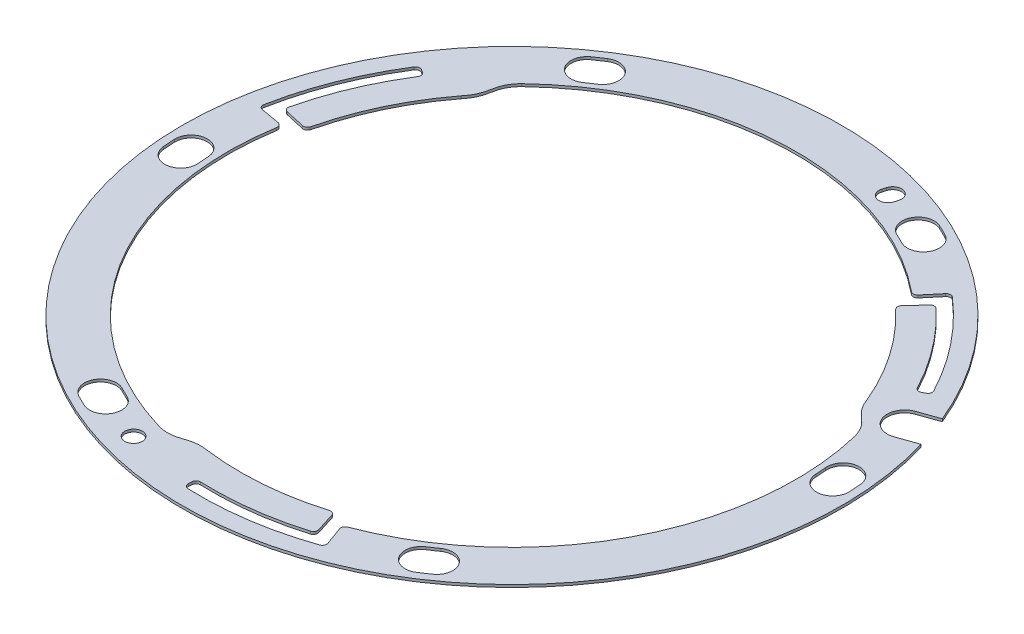
from build123d import *

# Parameters (mm, degrees)
SKETCH1_R               = 38
BOSS_EXTRUDE1_DEPTH     = 0.3
CUT_EXTRUDE1_DEPTH      = 54.740952727
CUT_EXTRUDE1_DEPTH_BACK = 54.740952727
SKETCH2_R               = 1.015
FILLET2_R               = 0.5


with BuildPart() as part:
    # Sketch1 → Boss-Extrude1 (new body)
    with BuildSketch(Plane(origin=(0, 0, 0), x_dir=(1, 0, 0), z_dir=(0, 1, 0))):
        with Locations(Location((0, 0, 0), (0, 0, 270))):
            Circle(SKETCH1_R)
    extrude(amount=BOSS_EXTRUDE1_DEPTH)

    # Sketch2 → Cut-Extrude1 (cut, two sides: drawn at the far end of the back side and taken through both)
    with BuildSketch(Plane(origin=(0, 0.3, 0), x_dir=(1, 0, 0), z_dir=(0, 1, 0)).offset(-CUT_EXTRUDE1_DEPTH_BACK)):
        with BuildLine():
            ThreePointArc((-37.053075912, -1.865359337), (-37.012379228, -2.548290386), (-36.959096408, -3.230354883))
            ThreePointArc((-36.959096408, -3.230354883), (-34.955040212, -4.912246307), (-33.273148788, -2.908190111))
            ThreePointArc((-33.273148788, -2.908190111), (-33.321117688, -2.294148218), (-33.357755673, -1.679326196))
            ThreePointArc((-33.357755673, -1.679326196), (-35.298432363, 0.075317353), (-37.053075912, -1.865359337))
        make_face()
        with BuildLine():
            ThreePointArc((-16.911089383, -33.021584697), (-16.299305403, -33.327805859), (-15.681978812, -33.622693832))
            ThreePointArc((-15.681978812, -33.622693832), (-13.223390014, -32.728075967), (-14.118007879, -30.26948717))
            ThreePointArc((-14.118007879, -30.26948717), (-14.673768207, -30.004008509), (-15.22453869, -29.728326924))
            ThreePointArc((-15.22453869, -29.728326924), (-17.714442923, -30.531680464), (-16.911089383, -33.021584697))
        make_face()
        with Locations(Location((-9.752534436, -33.874039795, 0), (0, 0, 270))):
            Circle(SKETCH2_R)
        with BuildLine():
            ThreePointArc((20.141986529, -31.15622536), (20.713073824, -30.779515473), (21.277117596, -30.392338949))
            ThreePointArc((21.277117596, -30.392338949), (21.731650198, -27.81582966), (19.155140909, -27.361297059))
            ThreePointArc((19.155140909, -27.361297059), (18.647349481, -27.709860291), (18.133216983, -28.049000728))
            ThreePointArc((18.133216983, -28.049000728), (17.58398944, -30.606997817), (20.141986529, -31.15622536))
        make_face()
        with BuildLine():
            ThreePointArc((37.053075912, 1.865359337), (37.012379228, 2.548290386), (36.959096408, 3.230354883))
            ThreePointArc((36.959096408, 3.230354883), (34.955040212, 4.912246307), (33.273148788, 2.908190111))
            ThreePointArc((33.273148788, 2.908190111), (33.321117688, 2.294148218), (33.357755673, 1.679326196))
            ThreePointArc((33.357755673, 1.679326196), (35.298432363, -0.075317353), (37.053075912, 1.865359337))
        make_face()
        with BuildLine():
            ThreePointArc((16.911089383, 33.021584697), (16.299305403, 33.327805859), (15.681978812, 33.622693832))
            ThreePointArc((15.681978812, 33.622693832), (13.223390014, 32.728075967), (14.118007879, 30.26948717))
            ThreePointArc((14.118007879, 30.26948717), (14.673768207, 30.004008509), (15.22453869, 29.728326924))
            ThreePointArc((15.22453869, 29.728326924), (17.714442923, 30.531680464), (16.911089383, 33.021584697))
        make_face()
        with BuildLine():
            ThreePointArc((-20.141986529, 31.15622536), (-20.713073824, 30.779515473), (-21.277117596, 30.392338949))
            ThreePointArc((-21.277117596, 30.392338949), (-21.731650198, 27.81582966), (-19.155140909, 27.361297059))
            ThreePointArc((-19.155140909, 27.361297059), (-18.647349481, 27.709860291), (-18.133216983, 28.049000728))
            ThreePointArc((-18.133216983, 28.049000728), (-17.58398944, 30.606997817), (-20.141986529, 31.15622536))
        make_face()
        with BuildLine():
            Line((-29.015113588, 18.848957093), (-30.189135525, 19.611631658))
            ThreePointArc((-30.189135525, 19.611631658), (-33.493010206, 13.199176768), (-35.452120741, 6.256767133))
            Line((-35.452120741, 6.256767133), (-32.251582063, 5.6919201))
            ThreePointArc((-32.251582063, 5.6919201), (-27.833314361, -17.258885007), (-9.23942383, -31.41966816))
            add(Edge.make_bspline(
                [(-4.046231948, -31.037364692), (-6.510871152, -30.608176232), (-6.812515045, -32.026230627), (-9.23942383, -31.41966816)],
                knots=[0, 0, 0, 0, 1, 1, 1, 1], degree=3))
            ThreePointArc((-4.046231948, -31.037364692), (2.745296544, -31.179373741), (9.407517011, -29.852782512))
            Line((9.407517011, -29.852782512), (10.399363852, -33.000200476))
            ThreePointArc((10.399363852, -33.000200476), (4.361224586, -34.324039974), (-1.816118884, -34.552304007))
            Line((-1.816118884, -34.552304007), (-1.889603463, -35.950374111))
            ThreePointArc((-1.889603463, -35.950374111), (5.315682713, -35.605386071), (12.307541088, -33.830820746))
            Line((12.307541088, -33.830820746), (11.196443628, -30.776649429))
            ThreePointArc((11.196443628, -30.776649429), (28.863290038, -15.474914804), (31.82994272, 7.708258327))
            add(Edge.make_bspline(
                [(28.902262264, 12.014542689), (29.762893756, 9.665508298), (31.141786833, 10.113304221), (31.82994272, 7.708258327)],
                knots=[0, 0, 0, 0, 1, 1, 1, 1], degree=3))
            ThreePointArc((28.902262264, 12.014542689), (25.629481462, 17.967183419), (21.149509523, 23.073539974))
            Line((21.149509523, 23.073539974), (23.379330016, 25.506213517))
            ThreePointArc((23.379330016, 25.506213517), (27.544878285, 20.93895127), (30.831232471, 15.703346914))
            Line((30.831232471, 15.703346914), (32.078738987, 16.338742454))
            ThreePointArc((32.078738987, 16.338742454), (28.177327493, 22.406209304), (23.144579654, 27.574053613))
            Line((23.144579654, 27.574053613), (21.055138435, 25.084729329))
            ThreePointArc((21.055138435, 25.084729329), (-1.029975677, 32.733799812), (-22.59051889, 23.711409833))
            add(Edge.make_bspline(
                [(-24.856030316, 19.022822003), (-23.252022604, 20.942667934), (-24.329271788, 21.912926407), (-22.59051889, 23.711409833)],
                knots=[0, 0, 0, 0, 1, 1, 1, 1], degree=3))
            ThreePointArc((-24.856030316, 19.022822003), (-28.374778006, 13.212190322), (-30.557026534, 6.779242538))
            Line((-30.557026534, 6.779242538), (-33.778693868, 7.493986959))
            ThreePointArc((-33.778693868, 7.493986959), (-31.906102871, 13.385088704), (-29.015113588, 18.848957093))
        make_face()
        with BuildLine():
            Line((36.454916606, 10.725626099), (34.146703694, 9.912246307))
            ThreePointArc((34.146703694, 9.912246307), (31.595686664, 11.133848581), (32.817288938, 13.68486561))
            Line((32.817288938, 13.68486561), (35.12550185, 14.498245403))
            ThreePointArc((35.12550185, 14.498245403), (35.83988338, 12.629440181), (36.454916606, 10.725626099))
        make_face()
        with BuildLine():
            ThreePointArc((10.799774466, 33.806672736), (10.098368991, 35.07524688), (8.829794847, 34.373841405))
            Line((8.829794847, 34.373841405), (8.705294407, 33.941406855))
            ThreePointArc((8.705294407, 33.941406855), (9.406699882, 32.672832711), (10.675274026, 33.374238186))
            Line((10.675274026, 33.374238186), (10.799774466, 33.806672736))
        make_face()
    extrude(amount=CUT_EXTRUDE1_DEPTH + CUT_EXTRUDE1_DEPTH_BACK, mode=Mode.SUBTRACT)

    # Fillet2
    fillet2_edges = [part.edges().sort_by_distance(p)[0] for p in [
        (-9.23942383, 0.15, 31.41966816),
        (-35.452120741, 0.15, -6.256767133),
        (-30.189135525, 0.15, -19.611631658),
        (-29.015113588, 0.15, -18.848957093),
        (-33.778693868, 0.15, -7.493986959),
        (-30.557026534, 0.15, -6.779242538),
        (-24.856030316, 0.15, -19.022822003),
        (-22.59051889, 0.15, -23.711409833),
        (21.055138435, 0.15, -25.084729329),
        (23.144579654, 0.15, -27.574053613),
        (32.078738987, 0.15, -16.338742454),
        (30.831232471, 0.15, -15.703346914),
        (23.379330016, 0.15, -25.506213517),
        (21.149509523, 0.15, -23.073539974),
        (28.902262264, 0.15, -12.014542689),
        (31.82994272, 0.15, -7.708258327),
        (11.196443628, 0.15, 30.776649429),
        (12.307541088, 0.15, 33.830820746),
        (-1.889603463, 0.15, 35.950374111),
        (-1.816118884, 0.15, 34.552304007),
        (10.399363852, 0.15, 33.000200476),
        (9.407517011, 0.15, 29.852782512),
        (-4.046231948, 0.15, 31.037364692),
        (-32.251582063, 0.15, -5.6919201),
    ]]
    fillet(fillet2_edges, radius=FILLET2_R)


solid = part.part
